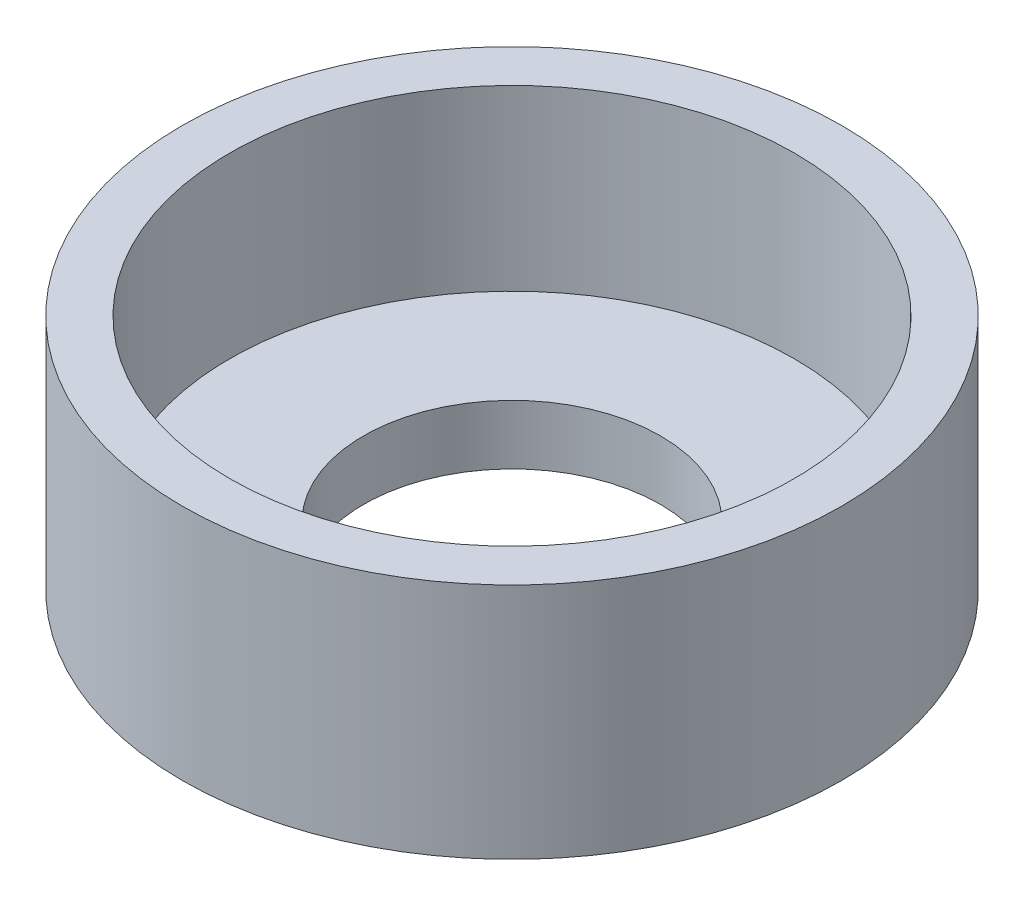
from build123d import *

# Parameters (mm, degrees)
SKETCH1_R           = 11.1
SKETCH1_R_2         = 5
BOSS_EXTRUDE1_DEPTH = 2
SKETCH2_R           = 11.1
SKETCH2_R_2         = 9.5
BOSS_EXTRUDE2_DEPTH = 6


with BuildPart() as part:
    # Sketch1 → Boss-Extrude1 (new body)
    with BuildSketch(Plane(origin=(0, 0, 0), x_dir=(1, 0, 0), z_dir=(0, 1, 0))):
        with Locations(Location((0, 0, 0), (0, 0, 270))):
            Circle(SKETCH1_R)
        with Locations(Location((0, 0, 0), (0, 0, 270))):
            Circle(SKETCH1_R_2, mode=Mode.SUBTRACT)
    extrude(amount=BOSS_EXTRUDE1_DEPTH)

    # Sketch2 → Boss-Extrude2 (add)
    with BuildSketch(Plane(origin=(0, 2, 0), x_dir=(1, 0, 0), z_dir=(0, 1, 0))):
        with Locations(Location((0, 0, 0), (0, 0, 270))):
            Circle(SKETCH2_R)
        with Locations(Location((0, 0, 0), (0, 0, 270))):
            Circle(SKETCH2_R_2, mode=Mode.SUBTRACT)
    extrude(amount=BOSS_EXTRUDE2_DEPTH)


solid = part.part
